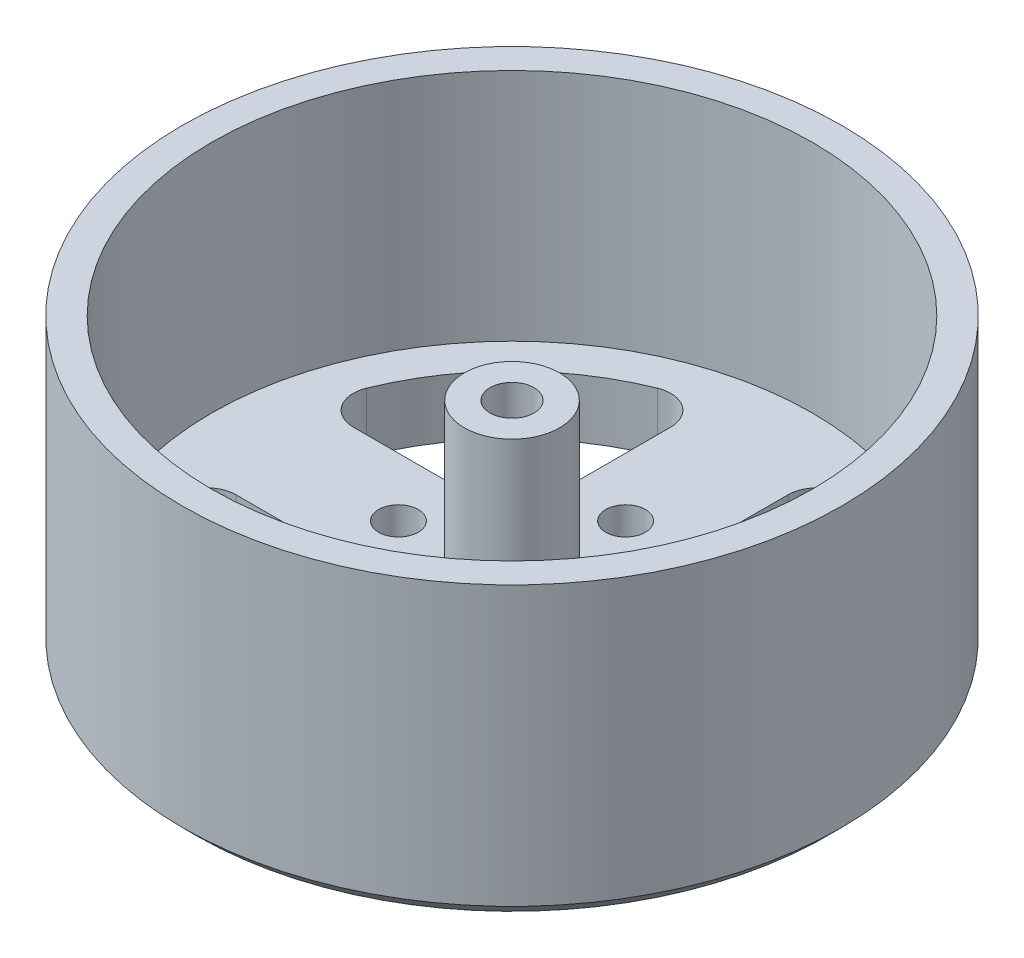
from build123d import *

# Parameters (mm, degrees)
SKETCH_1_R      = 20.5
SKETCH_1_R_2    = 1.35
SKETCH_1_R_3    = 3.25
EXTRUDE_1_DEPTH = 4
SKETCH_1_3_R    = 3.25
SKETCH_1_3_R_2  = 1.5
EXTRUDE_2_DEPTH = 15
SKETCH_1_4_R    = 22.5
SKETCH_1_4_R_2  = 20.5
EXTRUDE_3_DEPTH = 20
FILLET_1_R      = 5
FILLET_2_R      = 2
CHAMFER_1_SIZE  = 1


with BuildPart() as part:
    # 草图1 → 凸台-拉伸1 (new body)
    with BuildSketch(Plane(origin=(0, 0, 0), x_dir=(1, 0, 0), z_dir=(0, 1, 0))):
        Circle(SKETCH_1_R)
        with BuildLine():
            Line((-4, -4), (-4, -17.549928775))
            ThreePointArc((-4, -17.549928775), (-12.727922061, -12.727922061), (-17.549928775, -4))
            Line((-17.549928775, -4), (-4, -4))
        make_face(mode=Mode.SUBTRACT)
        with Locations((0, -7.75)):
            Circle(SKETCH_1_R_2, mode=Mode.SUBTRACT)
        with BuildLine():
            Line((4, -4), (17.549928775, -4))
            ThreePointArc((17.549928775, -4), (12.727922061, -12.727922061), (4, -17.549928775))
            Line((4, -17.549928775), (4, -4))
        make_face(mode=Mode.SUBTRACT)
        with Locations((-7.75, 0)):
            Circle(SKETCH_1_R_2, mode=Mode.SUBTRACT)
        with BuildLine():
            Line((-4, 4), (-17.549928775, 4))
            ThreePointArc((-17.549928775, 4), (-12.727922061, 12.727922061), (-4, 17.549928775))
            Line((-4, 17.549928775), (-4, 4))
        make_face(mode=Mode.SUBTRACT)
        Circle(SKETCH_1_R_3, mode=Mode.SUBTRACT)
        with Locations((7.75, 0)):
            Circle(SKETCH_1_R_2, mode=Mode.SUBTRACT)
        with Locations((0, 7.75)):
            Circle(SKETCH_1_R_2, mode=Mode.SUBTRACT)
        with BuildLine():
            Line((4, 4), (4, 17.549928775))
            ThreePointArc((4, 17.549928775), (12.727922061, 12.727922061), (17.549928775, 4))
            Line((17.549928775, 4), (4, 4))
        make_face(mode=Mode.SUBTRACT)
    extrude(amount=EXTRUDE_1_DEPTH)

    # 草图1<3> → 凸台-拉伸2 (add)
    with BuildSketch(Plane(origin=(0, 0, 0), x_dir=(1, 0, 0), z_dir=(0, 1, 0))):
        Circle(SKETCH_1_3_R)
        Circle(SKETCH_1_3_R_2, mode=Mode.SUBTRACT)
    extrude(amount=EXTRUDE_2_DEPTH)

    # 草图1<4> → 凸台-拉伸3 (add)
    with BuildSketch(Plane(origin=(0, 0, 0), x_dir=(1, 0, 0), z_dir=(0, 1, 0))):
        Circle(SKETCH_1_4_R)
        Circle(SKETCH_1_4_R_2, mode=Mode.SUBTRACT)
    extrude(amount=EXTRUDE_3_DEPTH)

    # 圆角1
    fillet_1_edges = [part.edges().sort_by_distance(p)[0] for p in [
        (-4, 2, 4),
        (4, 2, 4),
        (4, 2, -4),
        (-4, 2, -4),
    ]]
    fillet(fillet_1_edges, radius=FILLET_1_R)

    # 圆角2
    fillet_2_edges = [part.edges().sort_by_distance(p)[0] for p in [
        (4, 2, 17.549928775),
        (17.549928775, 2, 4),
        (17.549928775, 2, -4),
        (4, 2, -17.549928775),
        (-4, 2, 17.549928775),
        (-17.549928775, 2, 4),
        (-4, 2, -17.549928775),
        (-17.549928775, 2, -4),
    ]]
    fillet(fillet_2_edges, radius=FILLET_2_R)

    # 倒角1
    chamfer_1_edges = [part.edges().sort_by_distance(p)[0] for p in [
        (-22.5, 0, 0),
    ]]
    chamfer(chamfer_1_edges, length=CHAMFER_1_SIZE)


solid = part.part
